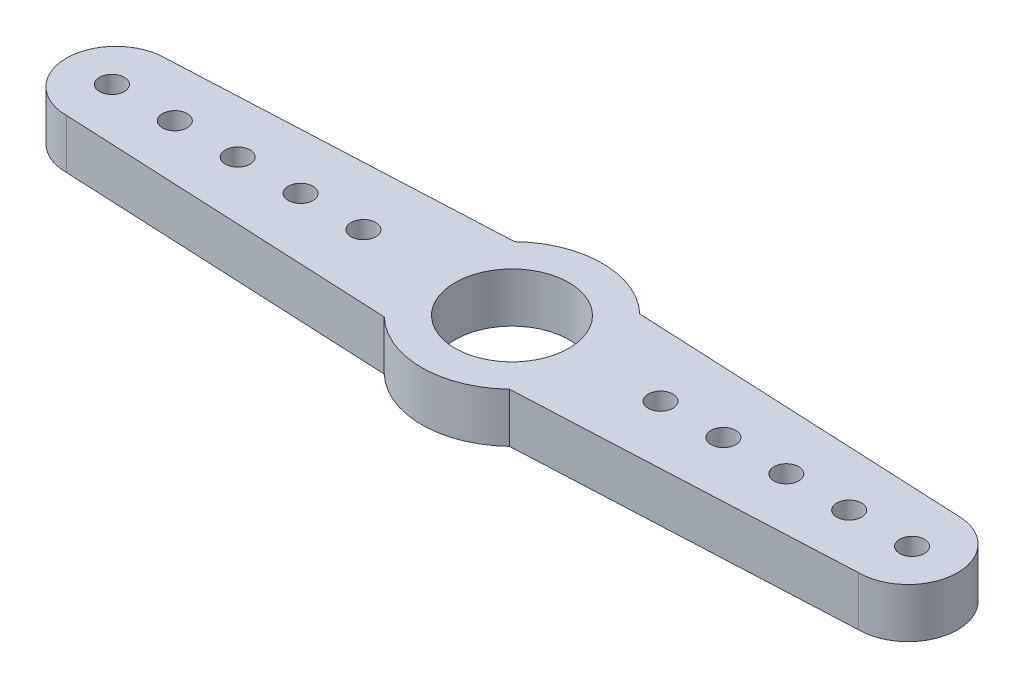
from build123d import *

# Parameters (mm, degrees)
SKETCH1_R           = 2.3
SKETCH1_R_2         = 0.5
BOSS_EXTRUDE1_DEPTH = 2


with BuildPart() as part:
    # Sketch1 → Boss-Extrude1 (new body)
    with BuildSketch(Plane(origin=(0, 0, 0), x_dir=(1, 0, 0), z_dir=(0, 1, 0))):
        with BuildLine():
            Line((-16, -2), (-2.528486514, -2.632548127))
            ThreePointArc((-2.528486514, -2.632548127), (1e-09, -3.650200137), (2.528486517, -2.632548127))
            Line((2.528486517, -2.632548127), (16, -2))
            ThreePointArc((16, -2), (18, 0), (16, 2))
            Line((16, 2), (2.528048307, 2.632568703))
            ThreePointArc((2.528048307, 2.632568703), (1e-09, 3.649799863), (-2.528048304, 2.632568703))
            Line((-2.528048304, 2.632568703), (-16, 2))
            ThreePointArc((-16, 2), (-18, 0), (-16, -2))
        make_face()
        with Locations(Location((0, 0, 0), (0, 0, 270))):
            Circle(SKETCH1_R, mode=Mode.SUBTRACT)
        with Locations(Location((-6, 0, 0), (0, 0, 270))):
            Circle(SKETCH1_R_2, mode=Mode.SUBTRACT)
        with Locations(Location((-8.54, 0, 0), (0, 0, 270))):
            Circle(SKETCH1_R_2, mode=Mode.SUBTRACT)
        with Locations(Location((-11.08, 0, 0), (0, 0, 270))):
            Circle(SKETCH1_R_2, mode=Mode.SUBTRACT)
        with Locations(Location((-13.62, 0, 0), (0, 0, 270))):
            Circle(SKETCH1_R_2, mode=Mode.SUBTRACT)
        with Locations(Location((-16.16, 0, 0), (0, 0, 270))):
            Circle(SKETCH1_R_2, mode=Mode.SUBTRACT)
        with Locations(Location((16.16, 0, 0), (0, 0, 90))):
            Circle(SKETCH1_R_2, mode=Mode.SUBTRACT)
        with Locations(Location((13.62, 0, 0), (0, 0, 90))):
            Circle(SKETCH1_R_2, mode=Mode.SUBTRACT)
        with Locations(Location((11.08, 0, 0), (0, 0, 90))):
            Circle(SKETCH1_R_2, mode=Mode.SUBTRACT)
        with Locations(Location((8.54, 0, 0), (0, 0, 90))):
            Circle(SKETCH1_R_2, mode=Mode.SUBTRACT)
        with Locations(Location((6, 0, 0), (0, 0, 90))):
            Circle(SKETCH1_R_2, mode=Mode.SUBTRACT)
    extrude(amount=BOSS_EXTRUDE1_DEPTH)


solid = part.part
